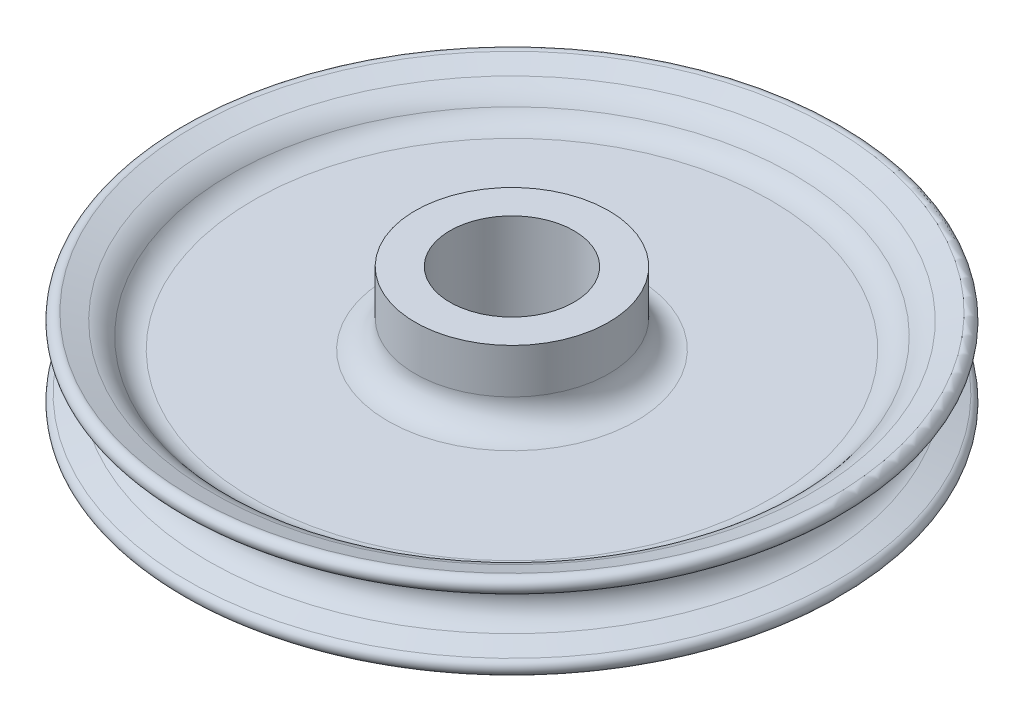
from build123d import *


with BuildPart() as part:
    # Sketch1 → Revolve1 (revolve)
    with BuildSketch(Plane.YZ, mode=Mode.PRIVATE) as revolve1_sk:
        with BuildLine():
            Line((-66, 50), (66, 50))
            Line((66, 50), (66, 78))
            Line((66, 78), (30, 78))
            ThreePointArc((30, 78), (14.443650814, 84.443650814), (8, 100))
            Line((8, 100), (8, 208.526478837))
            ThreePointArc((8, 208.526478837), (10.46502151, 218.645007158), (17.307692308, 226.496045483))
            ThreePointArc((17.307692308, 226.496045483), (24.020418259, 233.027256563), (28.392023293, 241.310159274))
            Line((28.392023293, 241.310159274), (34, 257.741988215))
            ThreePointArc((34, 257.741988215), (30.259563487, 265.358361019), (22.643190683, 261.617924505))
            Line((22.643190683, 261.617924505), (17.035213976, 245.186095564))
            ThreePointArc((17.035213976, 245.186095564), (0, 233), (-17.035213976, 245.186095564))
            Line((-17.035213976, 245.186095564), (-22.643190683, 261.617924505))
            ThreePointArc((-22.643190683, 261.617924505), (-30.259563487, 265.358361019), (-34, 257.741988215))
            Line((-34, 257.741988215), (-28.392023293, 241.310159274))
            ThreePointArc((-28.392023293, 241.310159274), (-24.020418259, 233.027256563), (-17.307692308, 226.496045483))
            ThreePointArc((-17.307692308, 226.496045483), (-10.46502151, 218.645007158), (-8, 208.526478837))
            Line((-8, 208.526478837), (-8, 100))
            ThreePointArc((-8, 100), (-14.443650814, 84.443650814), (-30, 78))
            Line((-30, 78), (-66, 78))
            Line((-66, 78), (-66, 50))
        make_face()
    revolve(revolve1_sk.sketch.rotate(Axis((0, -389.412948615, 0), (0, 1, 0)), 180), axis=Axis((0, -389.412948615, 0), (0, 1, 0)))


solid = part.part
